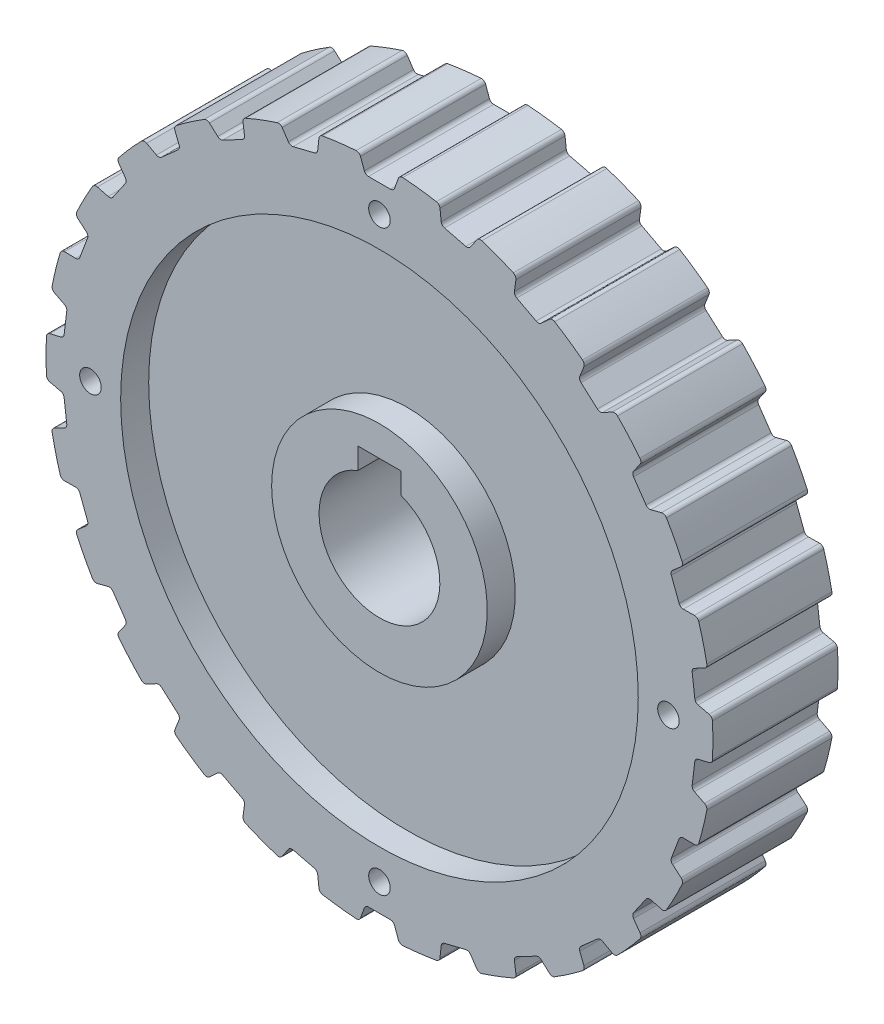
from build123d import *

# Parameters (mm, degrees)
CUT_EXTRUDE1_DEPTH              = 52.425309916
CUT_EXTRUDE1_DEPTH_BACK         = 52.425309916
SKETCH3_W                       = 5
SKETCH3_H                       = 9
M3X0_5_TAPPED_HOLE1_D           = 2.5
BOSS_EXTRUDE1_REACH             = 53.425
SKETCH7_R                       = 38.647197245
SKETCH7_R_2                     = 36
BOSS_EXTRUDE1_DIRECTION_2_REACH = 53.425
CUT_EXTRUDE2_DEPTH              = 56.134147402
CUT_EXTRUDE2_DEPTH_BACK         = 56.134147402
FILLET2_R                       = 0.51


with BuildPart() as part:
    # Sketch2 → Revolve1 (revolve)
    with BuildSketch(Plane(origin=(0, 0, 0), x_dir=(1, 0, 0), z_dir=(0, 1, 0)), mode=Mode.PRIVATE) as revolve1_sk:
        Polygon((7, 7.25), (12.5, 7.25), (12.5, 4), (30, 4), (30, 7.25), (36, 7.25), (36, -7.25), (30, -7.25), (30, -4), (12.5, -4), (12.5, -7.25), (7, -7.25), align=None)
    revolve(revolve1_sk.sketch.rotate(Axis((0, 0, -36.129595921), (0, 0, 1)), 180), axis=Axis((0, 0, -36.129595921), (0, 0, 1)))

    # Sketch3 → Cut-Extrude1 (cut, two sides: drawn at the far end of the back side and taken through both)
    with BuildSketch(Plane.XY.offset(-CUT_EXTRUDE1_DEPTH_BACK)):
        with Locations((0, 4.5)):
            Rectangle(SKETCH3_W, SKETCH3_H)
    extrude(amount=CUT_EXTRUDE1_DEPTH + CUT_EXTRUDE1_DEPTH_BACK, mode=Mode.SUBTRACT)

    # M3x0.5 Tapped Hole1 (through all)
    with Locations(Plane.XY.offset(7.25)):
        with Locations((0, 33.5), (33.5, 0), (-33.5, 0), (0, -33.5)):
            Hole(M3X0_5_TAPPED_HOLE1_D / 2)

    # Boss-Extrude1: up to this face of the body (flat: up to its plane)
    boss_extrude1_end = Plane(part.part.faces().sort_by_distance((34.981766235, 0, 7.25))[0])
    # Sketch7 → Boss-Extrude1 (add, up to the picked face)
    with BuildSketch(Plane.XY, mode=Mode.PRIVATE) as boss_extrude1_sk1:
        with Locations(Location((0, 0, 0), (0, 0, 180))):
            Circle(SKETCH7_R)
        Circle(SKETCH7_R_2, mode=Mode.SUBTRACT)
    boss_extrude1_tool1 = split(extrude(boss_extrude1_sk1.sketch, amount=BOSS_EXTRUDE1_REACH, mode=Mode.PRIVATE), bisect_by=boss_extrude1_end, keep=Keep.BOTH, mode=Mode.PRIVATE)
    add(boss_extrude1_tool1.solids().sort_by(Axis((37.554089, 0, 0), (0, 0, 1)))[0])

    # Boss-Extrude1 direction 2: up to this face of the body (flat: up to its plane)
    boss_extrude1_direction_2_end = Plane(part.part.faces().sort_by_distance((34.981766235, 0, -7.25))[0])
    # Sketch7 → Boss-Extrude1 direction 2 (add, up to the picked face)
    with BuildSketch(Plane.XY, mode=Mode.PRIVATE) as boss_extrude1_direction_2_sk1:
        with Locations(Location((0, 0, 0), (0, 0, 180))):
            Circle(SKETCH7_R)
        Circle(SKETCH7_R_2, mode=Mode.SUBTRACT)
    boss_extrude1_direction_2_tool1 = split(extrude(boss_extrude1_direction_2_sk1.sketch, amount=-BOSS_EXTRUDE1_DIRECTION_2_REACH, mode=Mode.PRIVATE), bisect_by=boss_extrude1_direction_2_end, keep=Keep.BOTH, mode=Mode.PRIVATE)
    add(boss_extrude1_direction_2_tool1.solids().sort_by(Axis((37.554089, 0, 0), (0, 0, -1)))[0])

    # Sketch8 → Cut-Extrude2 (cut, two sides: drawn at the far end of the back side and taken through both)
    with BuildSketch(Plane.XY.offset(-CUT_EXTRUDE2_DEPTH_BACK)):
        Polygon((-1.629816853, 36.667198316), (-2.350477527, 38.647197245), (2.350477527, 38.647197245), (1.629816853, 36.667198316), align=None)
        Polygon((7.192577586, 35.991756875), (6.96670276, 38.086686022), (11.531056603, 36.961673841), (10.357492259, 35.21167547), align=None)
        Polygon((15.596965558, 33.22460535), (15.879003605, 35.312715047), (20.041492583, 33.128072303), (18.483227864, 31.709778035), align=None)
        Polygon((23.094914586, 28.526560528), (23.868474478, 30.48649743), (27.387189863, 27.369187619), (25.534785449, 26.365023561), align=None)
        Polygon((29.250671124, 22.170655698), (30.470796374, 23.888515396), (33.141243215, 20.019705233), (31.102354119, 19.48802975), align=None)
        Polygon((33.706484978, 14.526272947), (35.30226634, 15.902219679), (36.969247976, 11.506750348), (34.86236702, 11.478462487), align=None)
        Polygon((36.203400443, 6.037676012), (38.082096906, 6.991744756), (38.648734422, 2.325064958), (36.596305869, 2.801808707), align=None)
        Polygon((36.596305869, -2.801808707), (38.648734422, -2.325064958), (38.082096906, -6.991744756), (36.203400443, -6.037676012), align=None)
        Polygon((34.86236702, -11.478462487), (36.969247976, -11.506750348), (35.30226634, -15.902219679), (33.706484978, -14.526272947), align=None)
        Polygon((31.102354119, -19.48802975), (33.141243215, -20.019705233), (30.470796374, -23.888515396), (29.250671124, -22.170655698), align=None)
        Polygon((25.534785449, -26.365023561), (27.387189863, -27.369187619), (23.868474478, -30.48649743), (23.094914586, -28.526560528), align=None)
        Polygon((18.483227864, -31.709778035), (20.041492583, -33.128072303), (15.879003605, -35.312715047), (15.596965558, -33.22460535), align=None)
        Polygon((10.357492259, -35.21167547), (11.531056603, -36.961673841), (6.96670276, -38.086686022), (7.192577586, -35.991756875), align=None)
        Polygon((1.629816853, -36.667198316), (2.350477527, -38.647197245), (-2.350477527, -38.647197245), (-1.629816853, -36.667198316), align=None)
        Polygon((-7.192577586, -35.991756875), (-6.96670276, -38.086686022), (-11.531056603, -36.961673841), (-10.357492259, -35.21167547), align=None)
        Polygon((-15.596965558, -33.22460535), (-15.879003605, -35.312715047), (-20.041492583, -33.128072303), (-18.483227864, -31.709778035), align=None)
        Polygon((-23.094914586, -28.526560528), (-23.868474478, -30.48649743), (-27.387189863, -27.369187619), (-25.534785449, -26.365023561), align=None)
        Polygon((-29.250671124, -22.170655698), (-30.470796374, -23.888515396), (-33.141243215, -20.019705233), (-31.102354119, -19.48802975), align=None)
        Polygon((-33.706484978, -14.526272947), (-35.30226634, -15.902219679), (-36.969247976, -11.506750348), (-34.86236702, -11.478462487), align=None)
        Polygon((-36.203400443, -6.037676012), (-38.082096906, -6.991744756), (-38.648734422, -2.325064958), (-36.596305869, -2.801808707), align=None)
        Polygon((-36.596305869, 2.801808707), (-38.648734422, 2.325064958), (-38.082096906, 6.991744756), (-36.203400443, 6.037676012), align=None)
        Polygon((-34.86236702, 11.478462487), (-36.969247976, 11.506750348), (-35.30226634, 15.902219679), (-33.706484978, 14.526272947), align=None)
        Polygon((-31.102354119, 19.48802975), (-33.141243215, 20.019705233), (-30.470796374, 23.888515396), (-29.250671124, 22.170655698), align=None)
        Polygon((-25.534785449, 26.365023561), (-27.387189863, 27.369187619), (-23.868474478, 30.48649743), (-23.094914586, 28.526560528), align=None)
        Polygon((-18.483227864, 31.709778035), (-20.041492583, 33.128072303), (-15.879003605, 35.312715047), (-15.596965558, 33.22460535), align=None)
        Polygon((-10.357492259, 35.21167547), (-11.531056603, 36.961673841), (-6.96670276, 38.086686022), (-7.192577586, 35.991756875), align=None)
    extrude(amount=CUT_EXTRUDE2_DEPTH + CUT_EXTRUDE2_DEPTH_BACK, mode=Mode.SUBTRACT)

    # Fillet2
    fillet2_edges = [part.edges().sort_by_distance(p)[0] for p in [
        (2.325, 38.577198316, 0),
        (-2.325, 38.577198316, 0),
        (-6.974688116, 38.012623963, 0),
        (-11.489567567, 36.899806124, 0),
        (-15.86903271, 35.238894076, 0),
        (-19.986403229, 33.077931326, 0),
        (-23.841126805, 30.417207754, 0),
        (-27.321701784, 27.333687393, 0),
        (-30.427661269, 23.827783879, 0),
        (-33.069162341, 20.000908903, 0),
        (-35.24585066, 15.853575815, 0),
        (-36.894763385, 11.505750287, 0),
        (-38.015679324, 6.958015551, 0),
        (-38.576174887, 2.341919286, 0),
        (-38.576174887, -2.341919286, 0),
        (-38.015679324, -6.958015551, 0),
        (-36.894763385, -11.505750287, 0),
        (-35.24585066, -15.853575815, 0),
        (-33.069162341, -20.000908903, 0),
        (-30.427661269, -23.827783879, 0),
        (-27.321701784, -27.333687393, 0),
        (-23.841126805, -30.417207754, 0),
        (-19.986403229, -33.077931326, 0),
        (-15.86903271, -35.238894076, 0),
        (-11.489567567, -36.899806124, 0),
        (-6.974688116, -38.012623963, 0),
        (-2.325, -38.577198316, 0),
        (2.325, -38.577198316, 0),
        (6.974688116, -38.012623963, 0),
        (11.489567567, -36.899806124, 0),
        (15.86903271, -35.238894076, 0),
        (19.986403229, -33.077931326, 0),
        (23.841126805, -30.417207754, 0),
        (27.321701784, -27.333687393, 0),
        (30.427661269, -23.827783879, 0),
        (33.069162341, -20.000908903, 0),
        (35.24585066, -15.853575815, 0),
        (36.894763385, -11.505750287, 0),
        (38.015679324, -6.958015551, 0),
        (38.576174887, -2.341919286, 0),
        (38.576174887, 2.341919286, 0),
        (38.015679324, 6.958015551, 0),
        (36.894763385, 11.505750287, 0),
        (35.24585066, 15.853575815, 0),
        (33.069162341, 20.000908903, 0),
        (30.427661269, 23.827783879, 0),
        (27.321701784, 27.333687393, 0),
        (23.841126805, 30.417207754, 0),
        (19.986403229, 33.077931326, 0),
        (15.86903271, 35.238894076, 0),
        (11.489567567, 36.899806124, 0),
        (6.974688116, 38.012623963, 0),
        (7.192577586, 35.991756875, 0),
        (10.357492259, 35.21167547, 0),
        (15.596965558, 33.22460535, 0),
        (18.483227864, 31.709778035, 0),
        (23.094914586, 28.526560528, 0),
        (25.534785449, 26.365023561, 0),
        (29.250671124, 22.170655698, 0),
        (31.102354119, 19.48802975, 0),
        (33.706484978, 14.526272947, 0),
        (34.86236702, 11.478462487, 0),
        (36.203400443, 6.037676012, 0),
        (36.596305869, 2.801808707, 0),
        (36.596305869, -2.801808707, 0),
        (36.203400443, -6.037676012, 0),
        (34.86236702, -11.478462487, 0),
        (33.706484978, -14.526272947, 0),
        (31.102354119, -19.48802975, 0),
        (29.250671124, -22.170655698, 0),
        (25.534785449, -26.365023561, 0),
        (23.094914586, -28.526560528, 0),
        (18.483227864, -31.709778035, 0),
        (15.596965558, -33.22460535, 0),
        (10.357492259, -35.21167547, 0),
        (7.192577586, -35.991756875, 0),
        (1.629816853, -36.667198316, 0),
        (-1.629816853, -36.667198316, 0),
        (-7.192577586, -35.991756875, 0),
        (-10.357492259, -35.21167547, 0),
        (-15.596965558, -33.22460535, 0),
        (-18.483227864, -31.709778035, 0),
        (-23.094914586, -28.526560528, 0),
        (-25.534785449, -26.365023561, 0),
        (-29.250671124, -22.170655698, 0),
        (-31.102354119, -19.48802975, 0),
        (-33.706484978, -14.526272947, 0),
        (-34.86236702, -11.478462487, 0),
        (-36.203400443, -6.037676012, 0),
        (-36.596305869, -2.801808707, 0),
        (-36.596305869, 2.801808707, 0),
        (-36.203400443, 6.037676012, 0),
        (-34.86236702, 11.478462487, 0),
        (-33.706484978, 14.526272947, 0),
        (-31.102354119, 19.48802975, 0),
        (-29.250671124, 22.170655698, 0),
        (-25.534785449, 26.365023561, 0),
        (-23.094914586, 28.526560528, 0),
        (-18.483227864, 31.709778035, 0),
        (-15.596965558, 33.22460535, 0),
        (-10.357492259, 35.21167547, 0),
        (-7.192577586, 35.991756875, 0),
        (-1.629816853, 36.667198316, 0),
        (1.629816853, 36.667198316, 0),
    ]]
    fillet(fillet2_edges, radius=FILLET2_R)


solid = part.part
